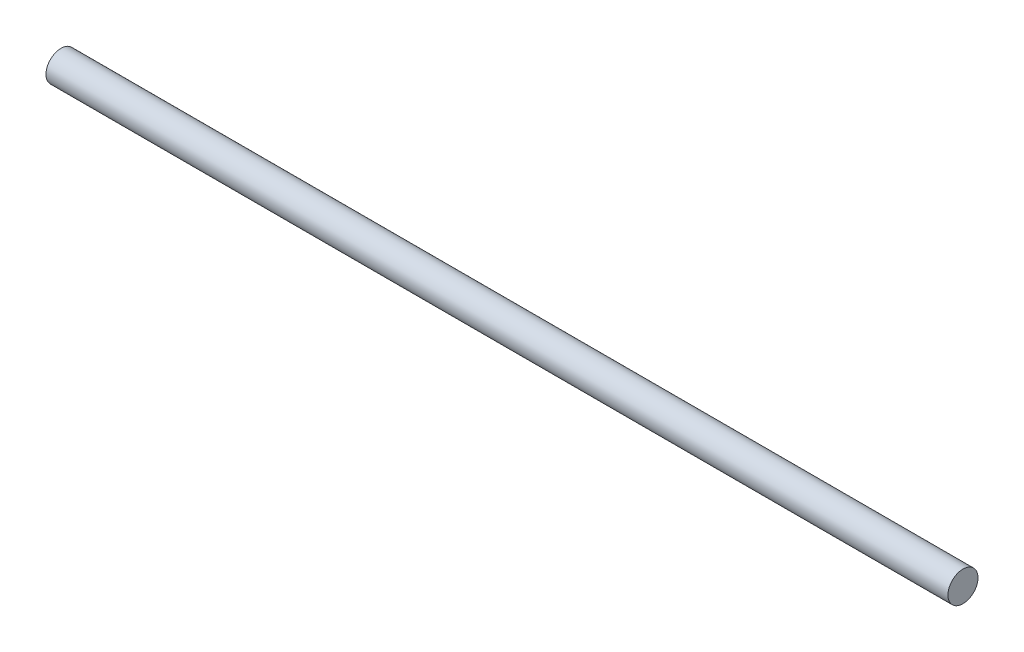
from build123d import *

# Parameters (mm, degrees)
SKETCH2_R           = 2.5
BOSS_EXTRUDE1_DEPTH = 150


with BuildPart() as part:
    # Sketch2 → Boss-Extrude1 (new body)
    with BuildSketch(Plane(origin=(0, 0, 0), x_dir=(0, 0, -1), z_dir=(1, 0, 0))):
        Circle(SKETCH2_R)
    extrude(amount=BOSS_EXTRUDE1_DEPTH)


solid = part.part
